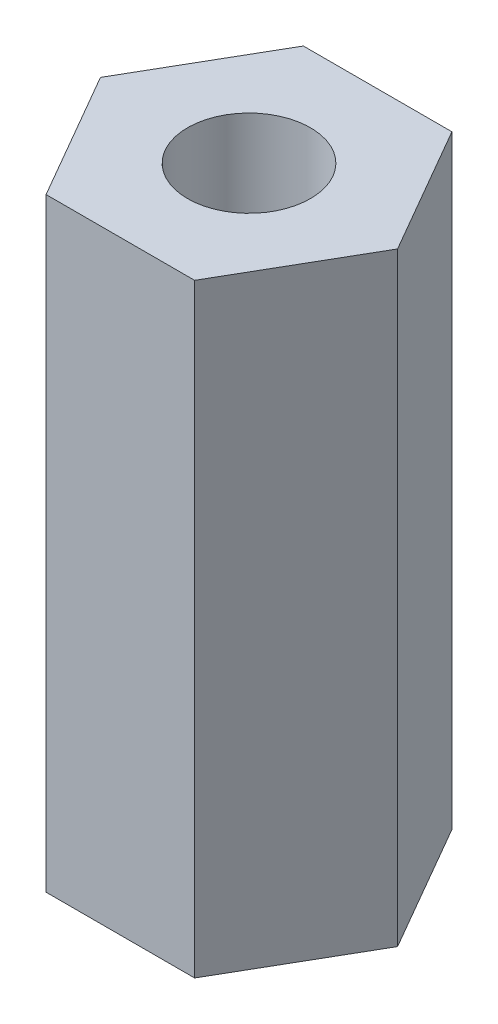
from build123d import *

# Parameters (mm, degrees)
BOSS_EXTRUDE1_DEPTH     = 18.669
TAP_DRILL_FOR_10_TAP1_D = 3.7973


with BuildPart() as part:
    # Sketch1 → Boss-Extrude1 (new body)
    with BuildSketch(Plane(origin=(0, 0, 0), x_dir=(1, 0, 0), z_dir=(0, 1, 0))):
        Polygon((4.59005011, 0), (2.295025055, 3.9751), (-2.295025055, 3.9751), (-4.59005011, 0), (-2.295025055, -3.9751), (2.295025055, -3.9751), align=None)
    extrude(amount=BOSS_EXTRUDE1_DEPTH)

    # Tap Drill for #10 Tap1 (through all)
    with Locations(Plane(origin=(0, 18.669, 0), x_dir=(-1, 0, 0), z_dir=(0, 1, 0))):
        with Locations((0, 0)):
            Hole(TAP_DRILL_FOR_10_TAP1_D / 2)


solid = part.part
